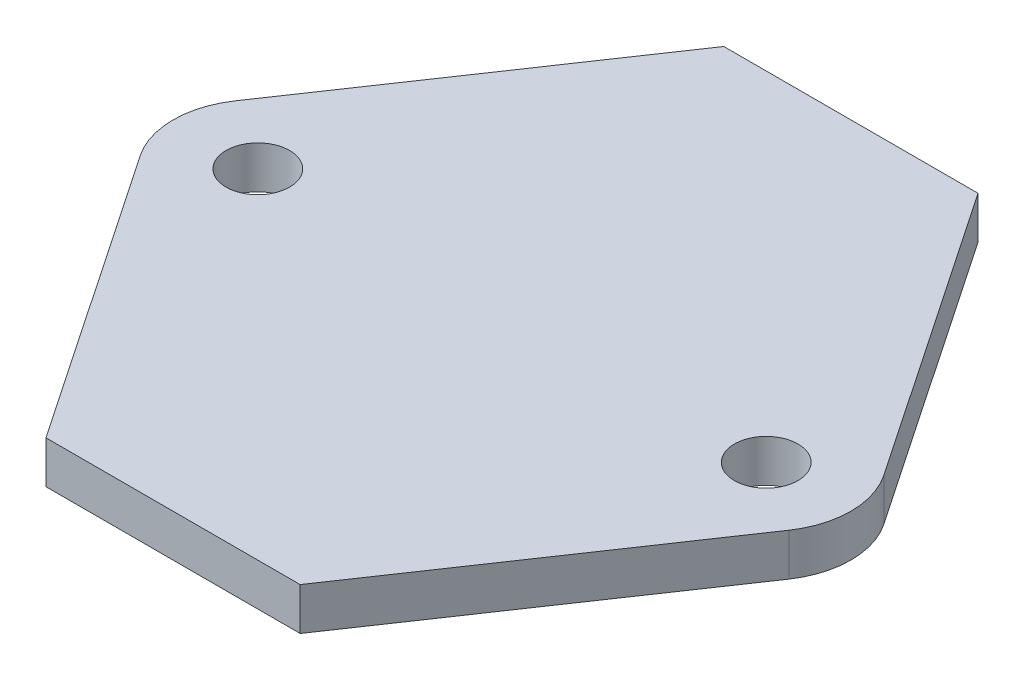
from build123d import *

# Parameters (mm, degrees)
BOSS_EXTRUDE1_DEPTH            = 1.5875
F_3_16_0_1875_DIAMETER_HOLE1_D = 4.7625


with BuildPart() as part:
    # Sketch1 → Boss-Extrude1 (new, symmetric)
    with BuildSketch(Plane(origin=(0, 0, 0), x_dir=(1, 0, 0), z_dir=(0, 1, 0))):
        with BuildLine():
            Line((24.308582085, 3.559468282), (9.525, 25.4))
            Line((9.525, 25.4), (-9.525, 25.4))
            Line((-9.525, 25.4), (-24.308582085, 3.559468282))
            ThreePointArc((-24.308582085, 3.559468282), (-25.4, 0), (-24.308582085, -3.559468282))
            Line((-24.308582085, -3.559468282), (-9.525, -25.4))
            Line((-9.525, -25.4), (9.525, -25.4))
            Line((9.525, -25.4), (24.308582085, -3.559468282))
            ThreePointArc((24.308582085, -3.559468282), (25.4, 0), (24.308582085, 3.559468282))
        make_face()
    extrude(amount=BOSS_EXTRUDE1_DEPTH, both=True)

    # 3/16 (0.1875) Diameter Hole1 (through all)
    with Locations(Plane(origin=(19.05, 1.5875, 0), x_dir=(0, 0, 1), z_dir=(0, 1, 0))):
        with Locations((0, 0), (0, -38.1)):
            Hole(F_3_16_0_1875_DIAMETER_HOLE1_D / 2)


solid = part.part
